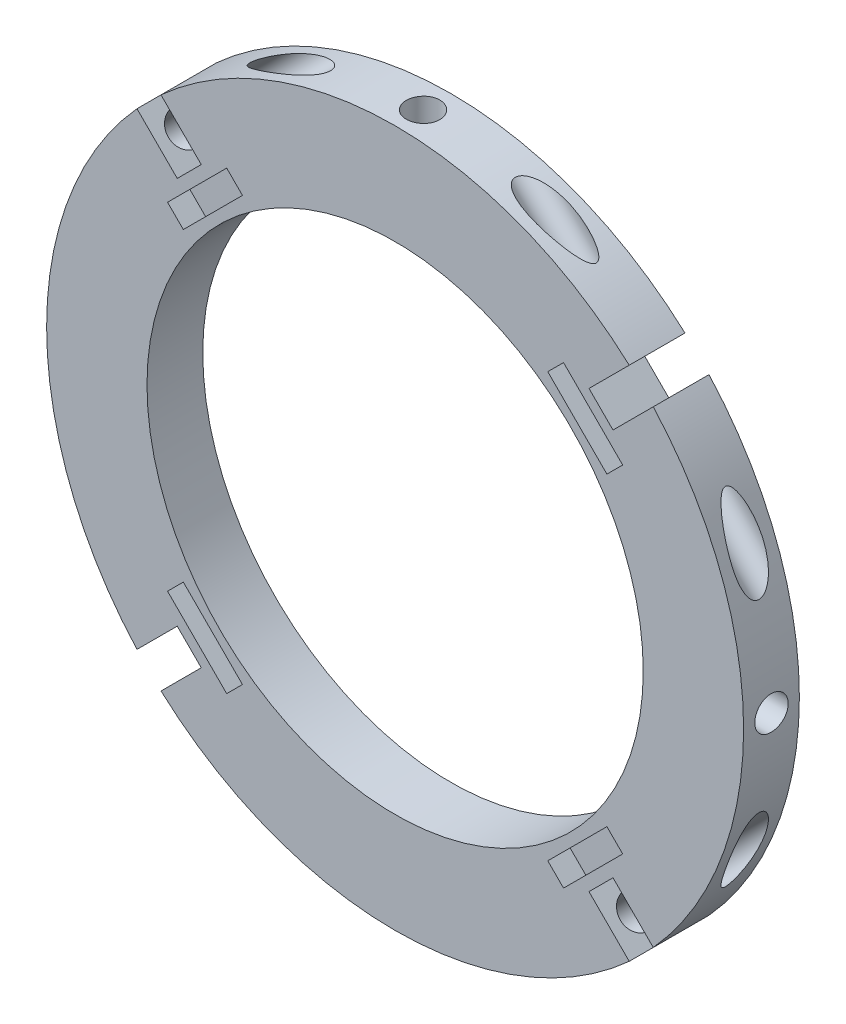
from build123d import *

# Parameters (mm, degrees)
SKETCH2_R           = 62.5
SKETCH2_R_2         = 44.5
BOSS_EXTRUDE2_DEPTH = 5
CUT_EXTRUDE1_DEPTH  = 10
CIRPATTERN3_COUNT   = 4
CUT_EXTRUDE2_DEPTH  = 4
CIRPATTERN4_COUNT   = 4
SKETCH4_R           = 3
CUT_EXTRUDE3_DEPTH  = 63
CIRPATTERN5_COUNT   = 4
CUT_EXTRUDE4_START  = 55
SKETCH5_R           = 3
CUT_EXTRUDE4_DEPTH  = 8
CIRPATTERN6_COUNT   = 4


with BuildPart() as part:
    # Sketch2 → Boss-Extrude2 (new, symmetric)
    with BuildSketch(Plane.XY):
        Circle(SKETCH2_R)
        Circle(SKETCH2_R_2, mode=Mode.SUBTRACT)
    extrude(amount=BOSS_EXTRUDE2_DEPTH, both=True)

    # Sketch3 → Cut-Extrude1 (cut)
    with BuildSketch(Plane.XY.offset(5)):
        with BuildLine():
            ThreePointArc((46.295002497, 41.988364386), (44.194173824, 44.194173824), (41.988364386, 46.295002497))
            Line((41.988364386, 46.295002497), (34.769486399, 39.076124511))
            Line((34.769486399, 39.076124511), (39.076124511, 34.769486399))
            Line((39.076124511, 34.769486399), (46.295002497, 41.988364386))
        make_face()
    cut_extrude1 = extrude(amount=-CUT_EXTRUDE1_DEPTH, mode=Mode.SUBTRACT)

    # CirPattern3: Cut-Extrude1 ×4 about axis
    cirpattern3_axis = Axis((0, 0, 0), (0, 0, 1))
    for i in range(1, CIRPATTERN3_COUNT):
        add(cut_extrude1.rotate(cirpattern3_axis, i * 360 / CIRPATTERN3_COUNT), mode=Mode.SUBTRACT)

    # Sketch3<3> → Cut-Extrude2 (cut)
    with BuildSketch(Plane.XY.offset(5)):
        Polygon((37.983465627, 27.376863909), (40.811892752, 30.205291034), (30.205291034, 40.811892752), (27.376863909, 37.983465627), align=None)
    cut_extrude2 = extrude(amount=-CUT_EXTRUDE2_DEPTH, mode=Mode.SUBTRACT)

    # CirPattern4: Cut-Extrude2 ×4 about axis
    cirpattern4_axis = Axis((0, 0, 0), (0, 0, 1))
    for i in range(1, CIRPATTERN4_COUNT):
        add(cut_extrude2.rotate(cirpattern4_axis, i * 360 / CIRPATTERN4_COUNT), mode=Mode.SUBTRACT)

    # Sketch4 → Cut-Extrude3 (cut, symmetric)
    with BuildSketch(Plane(origin=(-2.153319056, 2.153319056, 0), x_dir=(0, 0, -1), z_dir=(0.7071067811865478, -0.7071067811865472, 0))):
        with Locations(Location((0, 57.321249812, 0), (0, 0, 90))):
            Circle(SKETCH4_R)
    cut_extrude3 = extrude(amount=CUT_EXTRUDE3_DEPTH, both=True, mode=Mode.SUBTRACT)

    # CirPattern5: Cut-Extrude3 ×4 about axis
    cirpattern5_axis = Axis((0, 0, 5), (0, 0, -1))
    for i in range(1, CIRPATTERN5_COUNT):
        add(cut_extrude3.rotate(cirpattern5_axis, i * 360 / CIRPATTERN5_COUNT), mode=Mode.SUBTRACT)

    # Sketch5 → Cut-Extrude4 (cut)
    with BuildSketch(Plane(origin=(0, 0, 0), x_dir=(1, 0, 0), z_dir=(0, 1, 0)).offset(CUT_EXTRUDE4_START)):
        with Locations(Location((0, 0, 0), (0, 0, 90))):
            Circle(SKETCH5_R)
    cut_extrude4 = extrude(amount=CUT_EXTRUDE4_DEPTH, mode=Mode.SUBTRACT)

    # CirPattern6: Cut-Extrude4 ×4 about axis
    cirpattern6_axis = Axis((0, 0, 0), (0, 0, 1))
    for i in range(1, CIRPATTERN6_COUNT):
        add(cut_extrude4.rotate(cirpattern6_axis, i * 360 / CIRPATTERN6_COUNT), mode=Mode.SUBTRACT)


solid = part.part
